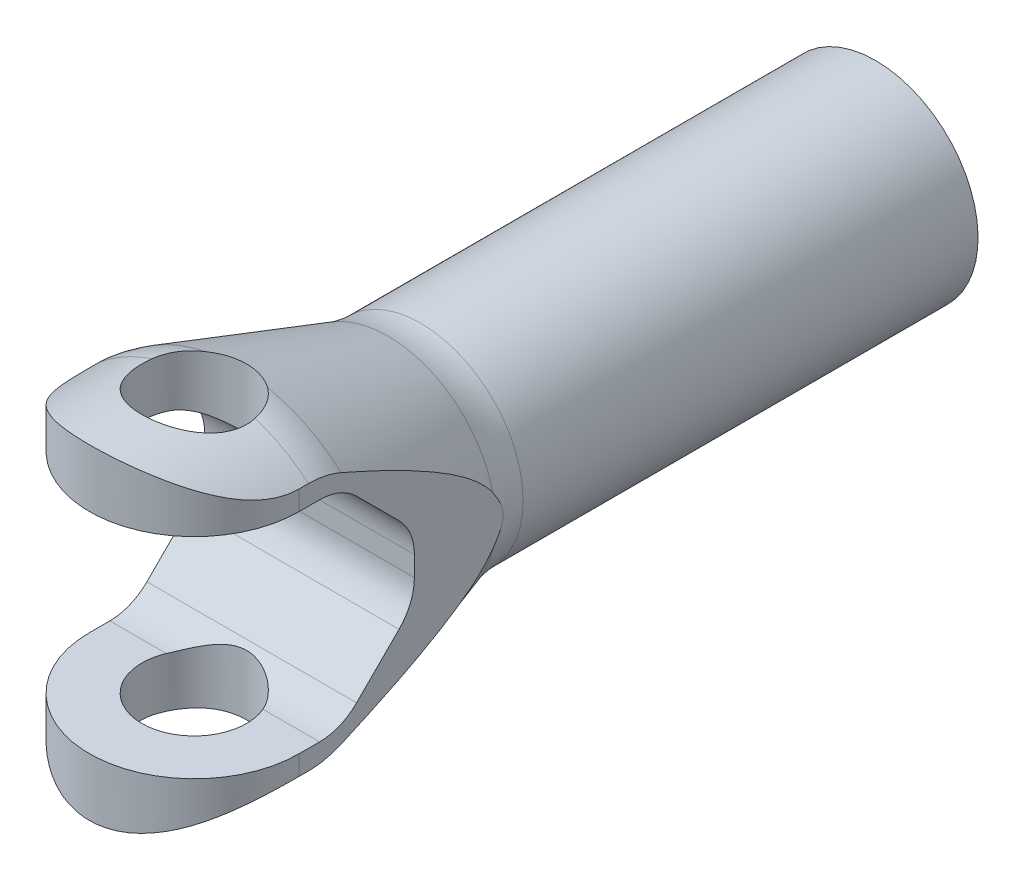
from build123d import *

# Parameters (mm, degrees)
CUT_EXTRUDE1_DEPTH      = 157.294477939
CUT_EXTRUDE1_DEPTH_BACK = 157.294477939
CUT_EXTRUDE3_DEPTH      = 156.280037628
CUT_EXTRUDE3_DEPTH_BACK = 156.280037628
CUT_EXTRUDE4_DEPTH      = 155.479713623
CUT_EXTRUDE4_DEPTH_BACK = 155.479713623
SKETCH4_R               = 10


with BuildPart() as part:
    # Sketch1 → Revolve1 (revolve)
    with BuildSketch(Plane(origin=(0, 0, 0), x_dir=(0, 0, -1), z_dir=(1, 0, 0))):
        with BuildLine():
            Line((0, 31.048058087), (0, 0))
            Line((0, 0), (150, 0))
            Line((150, 0), (150, 19.53096248))
            Line((150, 19.53096248), (63.206041057, 19.53096248))
            ThreePointArc((63.206041057, 19.53096248), (60.040415158, 19.783081261), (56.954600633, 20.533081214))
            Line((56.954600633, 20.533081214), (28.045399367, 30.045939353))
            ThreePointArc((28.045399367, 30.045939353), (24.959584842, 30.795939306), (21.793958943, 31.048058087))
            Line((21.793958943, 31.048058087), (0, 31.048058087))
        make_face()
    revolve(axis=Axis((0, 0, -150), (0, 0, 1)))

    # Sketch2 → Cut-Extrude1 (cut, two sides: drawn at the far end of the back side and taken through both)
    with BuildSketch(Plane(origin=(0, 0, 0), x_dir=(0, 0, -1), z_dir=(1, 0, 0)).offset(-CUT_EXTRUDE1_DEPTH_BACK)):
        with BuildLine():
            Line((0, 20), (0, -20))
            Line((0, -20), (23.903263743, -20))
            ThreePointArc((23.903263743, -20), (27.730098067, -19.238795325), (30.974331555, -17.071067812))
            Line((30.974331555, -17.071067812), (39.071067812, -8.974331555))
            ThreePointArc((39.071067812, -8.974331555), (41.238795325, -5.730098067), (42, -1.903263743))
            Line((42, -1.903263743), (42, 1.903263743))
            ThreePointArc((42, 1.903263743), (41.238795325, 5.730098067), (39.071067812, 8.974331555))
            Line((39.071067812, 8.974331555), (30.974331555, 17.071067812))
            ThreePointArc((30.974331555, 17.071067812), (27.730098067, 19.238795325), (23.903263743, 20))
            Line((23.903263743, 20), (0, 20))
        make_face()
    extrude(amount=CUT_EXTRUDE1_DEPTH + CUT_EXTRUDE1_DEPTH_BACK, mode=Mode.SUBTRACT)

    # Sketch3 → Cut-Extrude3 (cut, two sides: drawn at the far end of the back side and taken through both)
    with BuildSketch(Plane(origin=(0, 0, 0), x_dir=(1, 0, 0), z_dir=(0, 1, 0)).offset(-CUT_EXTRUDE3_DEPTH_BACK)):
        with BuildLine():
            ThreePointArc((0, 0), (-14.142135624, 5.857864376), (-20, 20))
            Line((-20, 20), (-20, 58.900056316))
            Line((-20, 58.900056316), (-33.967415872, 58.900056316))
            Line((-33.967415872, 58.900056316), (-33.967415872, 0))
            Line((-33.967415872, 0), (0, 0))
        make_face()
        with BuildLine():
            ThreePointArc((20, 20), (14.142135624, 5.857864376), (0, 0))
            Line((0, 0), (30.596408204, 0))
            Line((30.596408204, 0), (30.596408204, 58.900056316))
            Line((30.596408204, 58.900056316), (20, 58.900056316))
            Line((20, 58.900056316), (20, 20))
        make_face()
    extrude(amount=CUT_EXTRUDE3_DEPTH + CUT_EXTRUDE3_DEPTH_BACK, mode=Mode.SUBTRACT)

    # Sketch4 → Cut-Extrude4 (cut, two sides: drawn at the far end of the back side and taken through both)
    with BuildSketch(Plane(origin=(0, 0, 0), x_dir=(1, 0, 0), z_dir=(0, 1, 0)).offset(-CUT_EXTRUDE4_DEPTH_BACK)):
        with Locations(Location((0, 20, 0), (0, 0, 169.665425663))):
            Circle(SKETCH4_R)
    extrude(amount=CUT_EXTRUDE4_DEPTH + CUT_EXTRUDE4_DEPTH_BACK, mode=Mode.SUBTRACT)


solid = part.part
